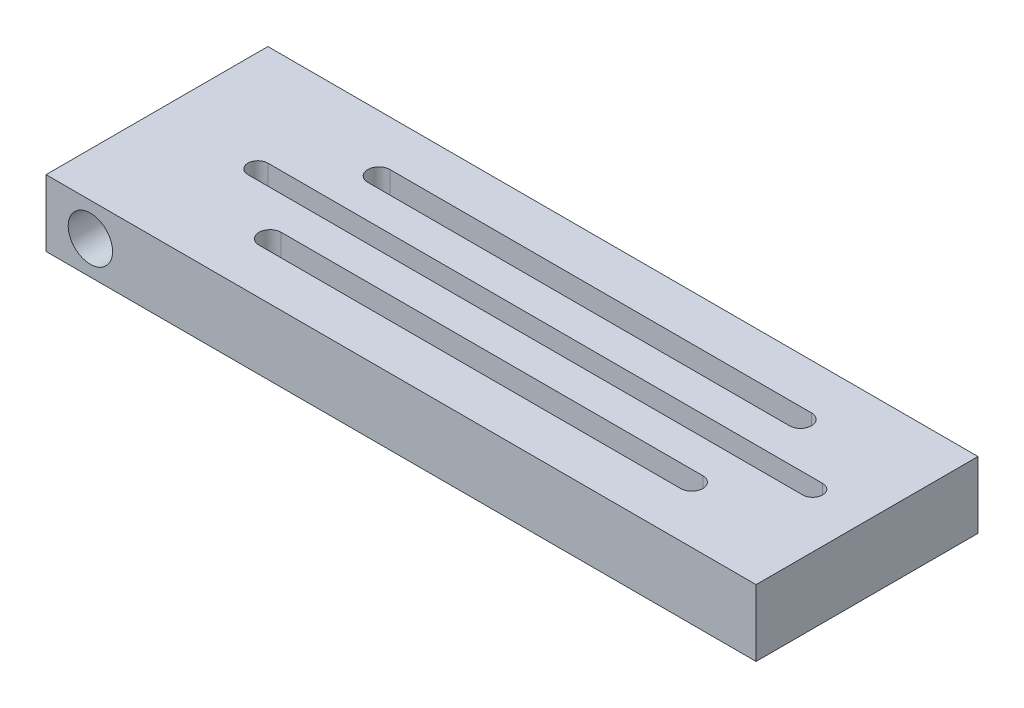
from build123d import *

# Parameters (mm, degrees)
SKETCH1_W           = 203.2
SKETCH1_H           = 63.5
BOSS_EXTRUDE1_DEPTH = 9.525
CUT_EXTRUDE1_DEPTH  = 109.136603424
CUT_EXTRUDE2_REACH  = 122.19
SKETCH3_R           = 6.35


with BuildPart() as part:
    # Sketch1 → Boss-Extrude1 (new, symmetric)
    with BuildSketch(Plane(origin=(0, 0, 0), x_dir=(1, 0, 0), z_dir=(0, 1, 0))):
        Rectangle(SKETCH1_W, SKETCH1_H)
    extrude(amount=BOSS_EXTRUDE1_DEPTH, both=True)

    # Sketch2 → Cut-Extrude1 (cut, through all)
    with BuildSketch(Plane(origin=(0, 9.525, 0), x_dir=(1, 0, 0), z_dir=(0, 1, 0))):
        with BuildLine():
            Line((-72.7075, 2.8575), (86.0425, 2.8575))
            ThreePointArc((86.0425, 2.8575), (88.9, 0), (86.0425, -2.8575))
            Line((86.0425, -2.8575), (-72.7075, -2.8575))
            ThreePointArc((-72.7075, -2.8575), (-75.565, 0), (-72.7075, 2.8575))
        make_face()
        with BuildLine():
            Line((-53.6575, 18.7325), (66.9925, 18.7325))
            ThreePointArc((66.9925, 18.7325), (70.1675, 15.5575), (66.9925, 12.3825))
            Line((66.9925, 12.3825), (-53.6575, 12.3825))
            ThreePointArc((-53.6575, 12.3825), (-56.8325, 15.5575), (-53.6575, 18.7325))
        make_face()
        with BuildLine():
            Line((-53.6575, -12.3825), (66.9925, -12.3825))
            ThreePointArc((66.9925, -12.3825), (70.1675, -15.5575), (66.9925, -18.7325))
            Line((66.9925, -18.7325), (-53.6575, -18.7325))
            ThreePointArc((-53.6575, -18.7325), (-56.8325, -15.5575), (-53.6575, -12.3825))
        make_face()
    extrude(amount=-CUT_EXTRUDE1_DEPTH, mode=Mode.SUBTRACT)

    # Sketch3 → Cut-Extrude2 (cut, up to next)
    with BuildSketch(Plane(origin=(0, 0, -31.75), x_dir=(-1, 0, 0), z_dir=(0, 0, -1)), mode=Mode.PRIVATE) as cut_extrude2_sk1:
        with Locations((88.9, 0)):
            Circle(SKETCH3_R)
    cut_extrude2_tool1 = extrude(cut_extrude2_sk1.sketch, amount=-CUT_EXTRUDE2_REACH, mode=Mode.PRIVATE) & part.part
    add(cut_extrude2_tool1.solids().sort_by_distance((-88.9, 0, -31.75))[0], mode=Mode.SUBTRACT)


solid = part.part
